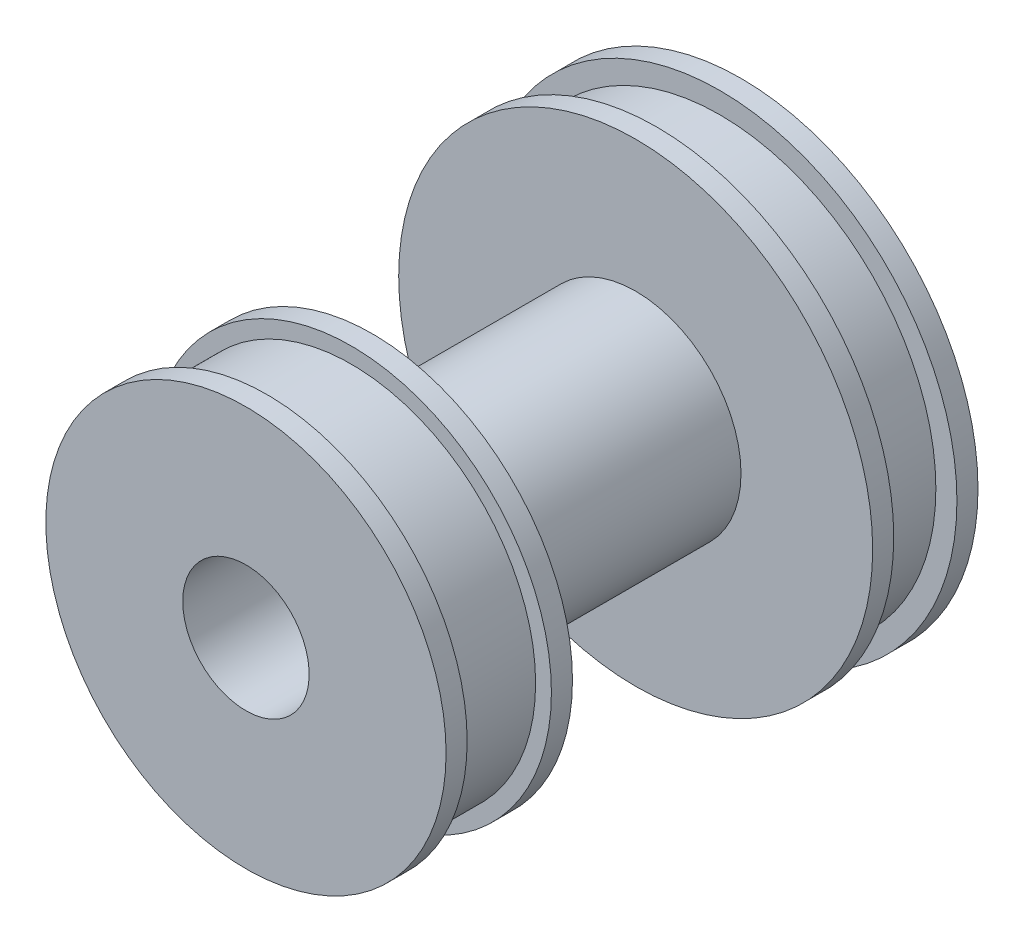
from build123d import *

# Parameters (mm, degrees)
SKIZZE1_R                        = 22.5
SEITE1_DEPTH                     = 2
SKIZZE2_R                        = 20.5
LAUFFL_CHE_DEPTH                 = 8
SKIZZE5_R                        = 22.5
SEITE_2_DEPTH                    = 2
BOHRUNG_DEPTH                    = 100
BOHRUNG_DEPTH_BACK               = 34.35416016
SKIZZE7_R                        = 2.5
SKIZZE9_R                        = 10
ZAPFEN_DEPTH                     = 25
SKIZZE10_R                       = 19
SEITENTEIL3_DEPTH                = 2
SKIZZE12_R                       = 17.5
ZAHNFL_CHE_DEPTH                 = 8
SKIZZE13_R                       = 19
SEITENTEIL4_DEPTH                = 2
F_12_0_12_DURCHMESSER_BOHRUNG1_D = 12


with BuildPart() as part:
    # Skizze1 → Seite1 (new body)
    with BuildSketch(Plane.XY):
        Circle(SKIZZE1_R)
    extrude(amount=SEITE1_DEPTH)

    # Skizze2 → Lauffläche (add)
    with BuildSketch(Plane.XY):
        Circle(SKIZZE2_R)
    extrude(amount=LAUFFL_CHE_DEPTH)

    # Skizze5 → Seite 2 (add)
    with BuildSketch(Plane.XY.offset(8)):
        Circle(SKIZZE5_R)
    extrude(amount=SEITE_2_DEPTH)

    # Skizze7 → Bohrung (cut, two sides: drawn at the far end of the back side and taken through both)
    with BuildSketch(Plane.XY.offset(-BOHRUNG_DEPTH_BACK)):
        Circle(SKIZZE7_R)
    extrude(amount=BOHRUNG_DEPTH + BOHRUNG_DEPTH_BACK, mode=Mode.SUBTRACT)

    # Skizze9 → Zapfen (add)
    with BuildSketch(Plane.XY.offset(10)):
        Circle(SKIZZE9_R)
    extrude(amount=ZAPFEN_DEPTH)

    # Skizze10 → Seitenteil3 (add)
    with BuildSketch(Plane.XY.offset(35)):
        Circle(SKIZZE10_R)
    extrude(amount=SEITENTEIL3_DEPTH)

    # Skizze12 → Zahnfläche (add)
    with BuildSketch(Plane.XY.offset(37)):
        Circle(SKIZZE12_R)
    extrude(amount=ZAHNFL_CHE_DEPTH)

    # Skizze13 → Seitenteil4 (add)
    with BuildSketch(Plane.XY.offset(45)):
        Circle(SKIZZE13_R)
    extrude(amount=SEITENTEIL4_DEPTH)

    # Ø12.0 (12) Durchmesser Bohrung1 (through all)
    with Locations(Plane(origin=(0, 0, 0), x_dir=(-1, 0, 0), z_dir=(0, 0, -1))):
        with Locations((0, 0)):
            Hole(F_12_0_12_DURCHMESSER_BOHRUNG1_D / 2)


solid = part.part
